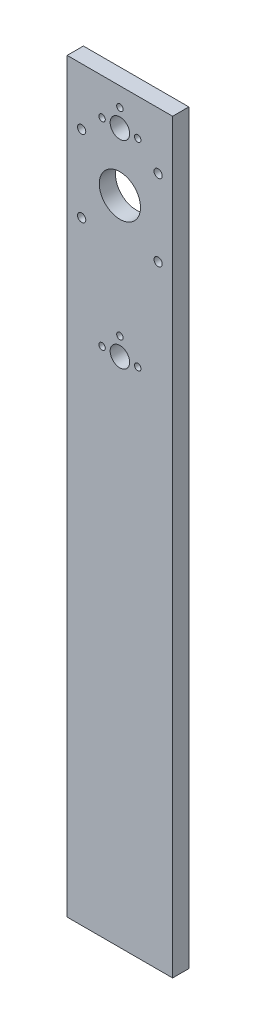
from build123d import *

# Parameters (mm, degrees)
SKETCH1_W           = 65
SKETCH1_H           = 460
SKETCH1_R           = 2.54
SKETCH1_R_2         = 6
SKETCH1_R_3         = 2
SKETCH1_R_4         = 12.7
BOSS_EXTRUDE1_DEPTH = 10


with BuildPart() as part:
    # Sketch1 → Boss-Extrude1 (new body)
    with BuildSketch(Plane.XY):
        with Locations((0, -191.425)):
            Rectangle(SKETCH1_W, SKETCH1_H)
        with Locations((-23.5712, 3.5712)):
            Circle(SKETCH1_R, mode=Mode.SUBTRACT)
        with Locations((23.5712, 3.5712)):
            Circle(SKETCH1_R, mode=Mode.SUBTRACT)
        with Locations((23.5712, -43.5712)):
            Circle(SKETCH1_R, mode=Mode.SUBTRACT)
        with Locations((-23.5712, -43.5712)):
            Circle(SKETCH1_R, mode=Mode.SUBTRACT)
        with Locations((0, -106)):
            Circle(SKETCH1_R_2, mode=Mode.SUBTRACT)
        with Locations((11, -106)):
            Circle(SKETCH1_R_3, mode=Mode.SUBTRACT)
        with Locations((0, -20)):
            Circle(SKETCH1_R_4, mode=Mode.SUBTRACT)
        with Locations((0, -95)):
            Circle(SKETCH1_R_3, mode=Mode.SUBTRACT)
        with Locations((0, 16)):
            Circle(SKETCH1_R_2, mode=Mode.SUBTRACT)
        with Locations((11, 16)):
            Circle(SKETCH1_R_3, mode=Mode.SUBTRACT)
        with Locations((-11, -106)):
            Circle(SKETCH1_R_3, mode=Mode.SUBTRACT)
        with Locations((0, 27)):
            Circle(SKETCH1_R_3, mode=Mode.SUBTRACT)
        with Locations((-11, 16)):
            Circle(SKETCH1_R_3, mode=Mode.SUBTRACT)
    extrude(amount=BOSS_EXTRUDE1_DEPTH)


solid = part.part
